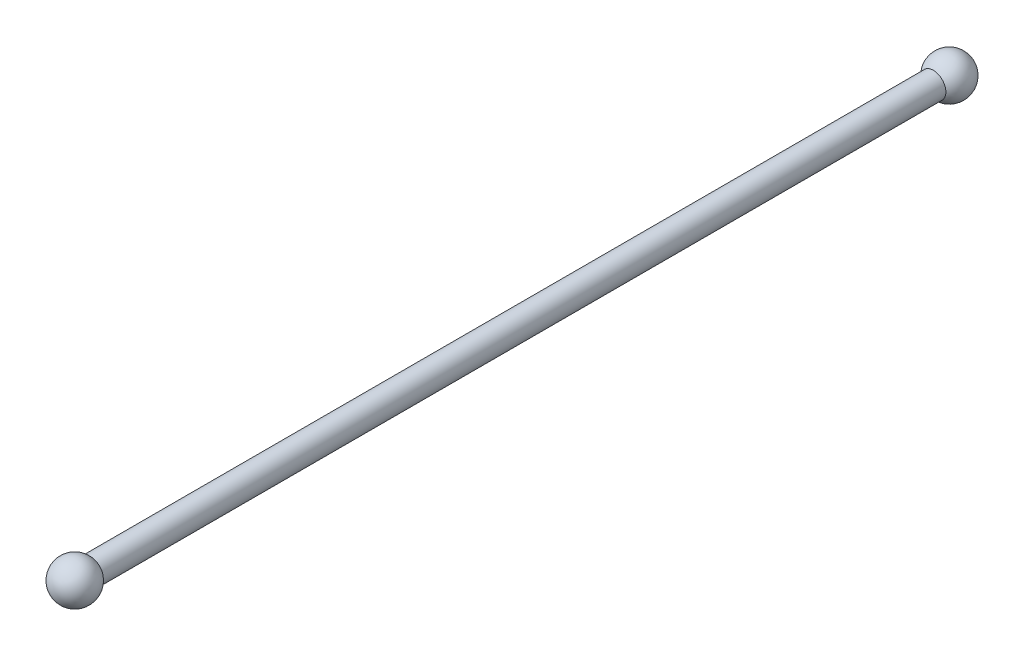
from build123d import *

# Parameters (mm, degrees)
SKETCH1_R           = 1.73
BOSS_EXTRUDE1_DEPTH = 116
DOME1_FACE_RADIUS   = 1.73
DOME1_HEIGHT        = 5
DOME2_FACE_RADIUS   = 1.73
DOME2_HEIGHT        = 5


with BuildPart() as part:
    # Sketch1 → Boss-Extrude1 (new body)
    with BuildSketch(Plane.XY):
        with Locations(Location((0, 0, 0), (0, 0, 180))):
            Circle(SKETCH1_R)
    extrude(amount=BOSS_EXTRUDE1_DEPTH)

    # Dome1: a dome of height H over a round flat face of radius A is a cap of a sphere of radius (A * A + H * H) / (2 * H)
    dome1_r = (DOME1_FACE_RADIUS * DOME1_FACE_RADIUS + DOME1_HEIGHT * DOME1_HEIGHT) / (2 * DOME1_HEIGHT)
    dome1_base = Plane((0, 0, 0), z_dir=(0, 0, -1))
    with Locations(dome1_base.offset(DOME1_HEIGHT - dome1_r)):
        dome1_ball = Sphere(dome1_r, mode=Mode.PRIVATE)
    add(split(dome1_ball, bisect_by=dome1_base, keep=Keep.TOP, mode=Mode.PRIVATE))

    # Dome2: a dome of height H over a round flat face of radius A is a cap of a sphere of radius (A * A + H * H) / (2 * H)
    dome2_r = (DOME2_FACE_RADIUS * DOME2_FACE_RADIUS + DOME2_HEIGHT * DOME2_HEIGHT) / (2 * DOME2_HEIGHT)
    dome2_base = Plane((0, 0, 116), z_dir=(0, 0, 1))
    with Locations(dome2_base.offset(DOME2_HEIGHT - dome2_r)):
        dome2_ball = Sphere(dome2_r, mode=Mode.PRIVATE)
    add(split(dome2_ball, bisect_by=dome2_base, keep=Keep.TOP, mode=Mode.PRIVATE))


solid = part.part
